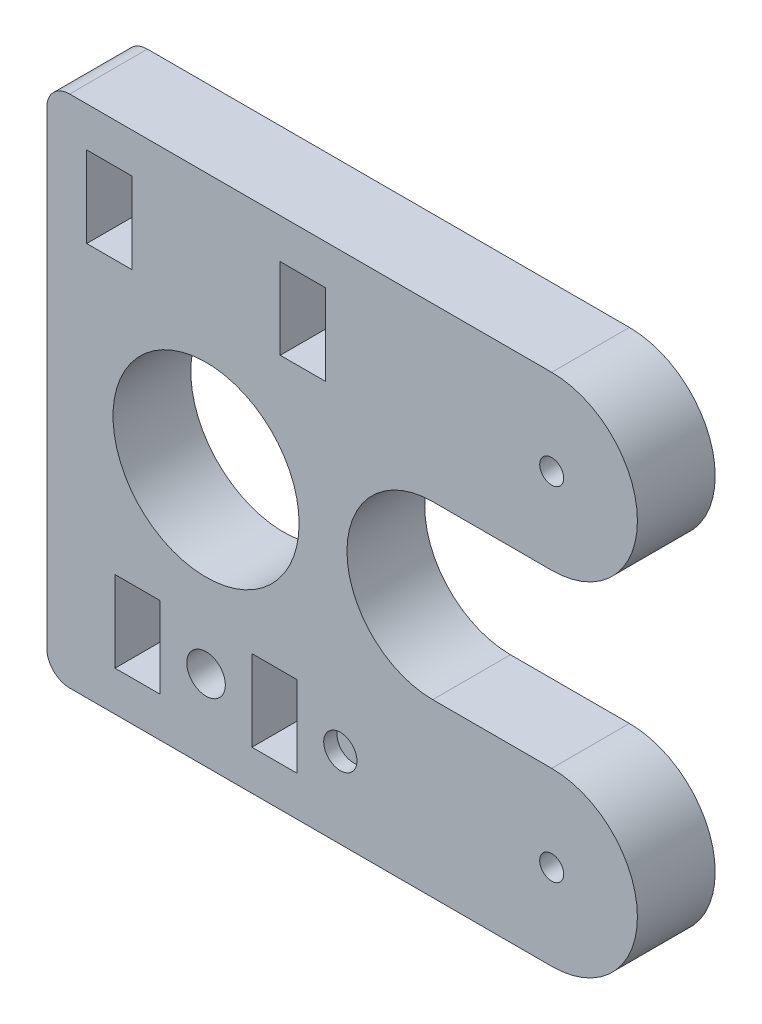
from build123d import *

# Parameters (mm, degrees)
SKETCH1_R           = 0.9
SKETCH1_R_2         = 1.45
SKETCH1_R_3         = 7
SKETCH1_W           = 3.400011
SKETCH1_H           = 6.1
SKETCH1_W_2         = 3.4
BOSS_EXTRUDE2_DEPTH = 5.85
SKETCH2_R           = 1.25
CUT_EXTRUDE1_DEPTH  = 1


with BuildPart() as part:
    # Sketch1 → Boss-Extrude2 (new body)
    with BuildSketch(Plane.XY):
        with BuildLine():
            Line((669.21684417, 350.11545661), (648.4638119, 350.11545661))
            ThreePointArc((648.4638119, 350.11545661), (647.249496344, 349.612470637), (646.746510371, 348.398155081))
            Line((646.746510371, 348.398155081), (646.746510371, 313.132758138))
            ThreePointArc((646.746510371, 313.132758138), (647.249496344, 311.918442582), (648.4638119, 311.41545661))
            Line((648.4638119, 311.41545661), (669.21684417, 311.41545661))
            Line((669.21684417, 311.41545661), (684.726521371, 311.41545661))
            ThreePointArc((684.726521371, 311.41545661), (691.176521371, 317.86545661), (684.726521371, 324.31545661))
            Line((684.726521371, 324.31545661), (675.776521371, 324.31545661))
            ThreePointArc((675.776521371, 324.31545661), (669.326521371, 330.76545661), (675.776521371, 337.21545661))
            Line((675.776521371, 337.21545661), (684.726521371, 337.21545661))
            ThreePointArc((684.726521371, 337.21545661), (691.176521371, 343.66545661), (684.726521371, 350.11545661))
            Line((684.726521371, 350.11545661), (669.21684417, 350.11545661))
        make_face()
        with Locations((684.726521371, 343.66545661)):
            Circle(SKETCH1_R, mode=Mode.SUBTRACT)
        with Locations((684.726521371, 317.86545661)):
            Circle(SKETCH1_R, mode=Mode.SUBTRACT)
        with Locations((658.726521371, 317.46545661)):
            Circle(SKETCH1_R_2, mode=Mode.SUBTRACT)
        with Locations((658.726521371, 330.76545661)):
            Circle(SKETCH1_R_3, mode=Mode.SUBTRACT)
        with Locations((651.446515871, 344.06545661)):
            Rectangle(SKETCH1_W, SKETCH1_H, mode=Mode.SUBTRACT)
        with Locations((653.576521371, 317.46545661)):
            Rectangle(SKETCH1_W_2, SKETCH1_H, mode=Mode.SUBTRACT)
        with Locations((666.006526871, 344.06545661)):
            Rectangle(SKETCH1_W, SKETCH1_H, mode=Mode.SUBTRACT)
        with Locations((663.876521371, 317.46545661)):
            Rectangle(SKETCH1_W_2, SKETCH1_H, mode=Mode.SUBTRACT)
    extrude(amount=BOSS_EXTRUDE2_DEPTH)

    # Sketch2 → Cut-Extrude1 (cut)
    with BuildSketch(Plane.XY.offset(5.85)):
        with Locations((668.826521371, 317.46545661)):
            Circle(SKETCH2_R)
    extrude(amount=-CUT_EXTRUDE1_DEPTH, mode=Mode.SUBTRACT)


solid = part.part
